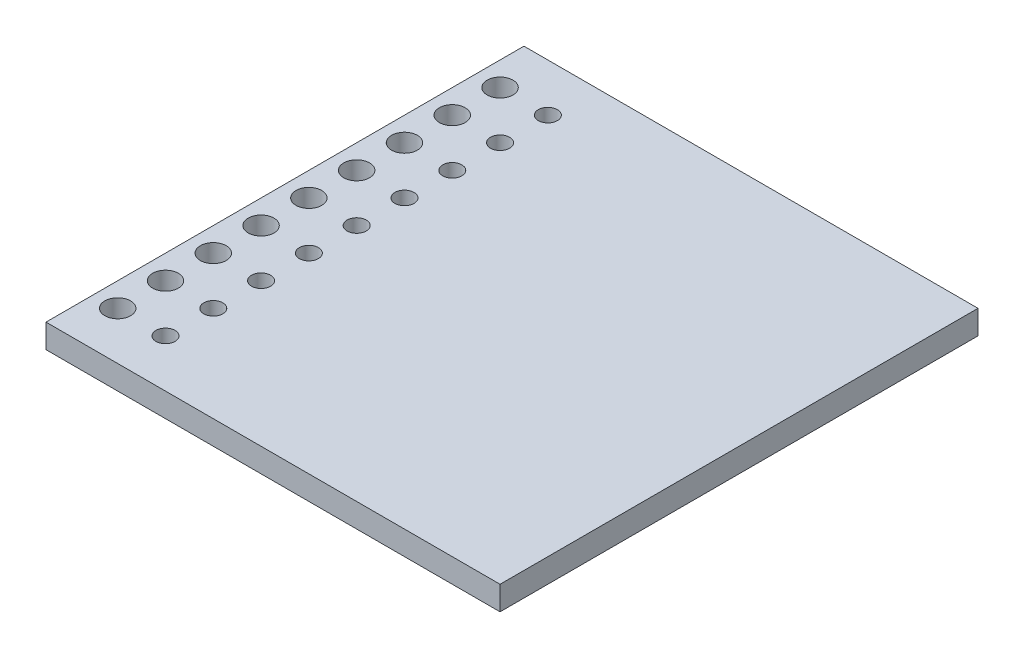
from build123d import *

# Parameters (mm, degrees)
SKETCH1_W           = 101.6
SKETCH1_H           = 127
BOSS_EXTRUDE1_DEPTH = 6.35
SKETCH3_W           = 63.5
SKETCH3_H           = 127
SKETCH3_R           = 3.429
BOSS_EXTRUDE2_DEPTH = 6.35
SKETCH4_W           = 44.45
SKETCH4_H           = 127
CUT_EXTRUDE2_DEPTH  = 131.908603613
SKETCH5_R           = 2.54
CUT_EXTRUDE4_DEPTH  = 95.612869104


with BuildPart() as part:
    # Sketch1 → Boss-Extrude1 (new body)
    with BuildSketch(Plane(origin=(0, 0, 0), x_dir=(1, 0, 0), z_dir=(0, 1, 0))):
        Rectangle(SKETCH1_W, SKETCH1_H)
    extrude(amount=BOSS_EXTRUDE1_DEPTH)

    # Sketch3 → Boss-Extrude2 (add)
    with BuildSketch(Plane(origin=(0, 6.35, 0), x_dir=(1, 0, 0), z_dir=(0, 1, 0))):
        with Locations((-82.55, 0)):
            Rectangle(SKETCH3_W, SKETCH3_H)
        with Locations(Location((-101.6, 50.8, 0), (0, 0, 270))):
            Circle(SKETCH3_R, mode=Mode.SUBTRACT)
        with Locations(Location((-88.9, 50.8, 0), (0, 0, 270))):
            Circle(SKETCH3_R, mode=Mode.SUBTRACT)
        with Locations(Location((-88.9, 38.1, 0), (0, 0, 270))):
            Circle(SKETCH3_R, mode=Mode.SUBTRACT)
        with Locations(Location((-101.6, 38.1, 0), (0, 0, 270))):
            Circle(SKETCH3_R, mode=Mode.SUBTRACT)
        with Locations(Location((-101.6, 25.4, 0), (0, 0, 270))):
            Circle(SKETCH3_R, mode=Mode.SUBTRACT)
        with Locations(Location((-88.9, 25.4, 0), (0, 0, 270))):
            Circle(SKETCH3_R, mode=Mode.SUBTRACT)
        with Locations(Location((-76.2, 50.8, 0), (0, 0, 270))):
            Circle(SKETCH3_R, mode=Mode.SUBTRACT)
        with Locations(Location((-63.5, 50.8, 0), (0, 0, 270))):
            Circle(SKETCH3_R, mode=Mode.SUBTRACT)
        with Locations(Location((-76.2, 38.1, 0), (0, 0, 270))):
            Circle(SKETCH3_R, mode=Mode.SUBTRACT)
        with Locations(Location((-63.5, 38.1, 0), (0, 0, 270))):
            Circle(SKETCH3_R, mode=Mode.SUBTRACT)
        with Locations(Location((-76.2, 25.4, 0), (0, 0, 270))):
            Circle(SKETCH3_R, mode=Mode.SUBTRACT)
        with Locations(Location((-63.5, 25.4, 0), (0, 0, 270))):
            Circle(SKETCH3_R, mode=Mode.SUBTRACT)
        with Locations(Location((-101.6, 12.7, 0), (0, 0, 270))):
            Circle(SKETCH3_R, mode=Mode.SUBTRACT)
        with Locations(Location((-88.9, 12.7, 0), (0, 0, 270))):
            Circle(SKETCH3_R, mode=Mode.SUBTRACT)
        with Locations(Location((-76.2, 12.7, 0), (0, 0, 270))):
            Circle(SKETCH3_R, mode=Mode.SUBTRACT)
        with Locations(Location((-63.5, 12.7, 0), (0, 0, 270))):
            Circle(SKETCH3_R, mode=Mode.SUBTRACT)
        with Locations(Location((-101.6, 0, 0), (0, 0, 270))):
            Circle(SKETCH3_R, mode=Mode.SUBTRACT)
        with Locations(Location((-88.9, 0, 0), (0, 0, 270))):
            Circle(SKETCH3_R, mode=Mode.SUBTRACT)
        with Locations(Location((-76.2, 0, 0), (0, 0, 270))):
            Circle(SKETCH3_R, mode=Mode.SUBTRACT)
        with Locations(Location((-63.5, 0, 0), (0, 0, 270))):
            Circle(SKETCH3_R, mode=Mode.SUBTRACT)
        with Locations(Location((-101.6, -12.7, 0), (0, 0, 270))):
            Circle(SKETCH3_R, mode=Mode.SUBTRACT)
        with Locations(Location((-88.9, -12.7, 0), (0, 0, 270))):
            Circle(SKETCH3_R, mode=Mode.SUBTRACT)
        with Locations(Location((-76.2, -12.7, 0), (0, 0, 270))):
            Circle(SKETCH3_R, mode=Mode.SUBTRACT)
        with Locations(Location((-63.5, -12.7, 0), (0, 0, 270))):
            Circle(SKETCH3_R, mode=Mode.SUBTRACT)
        with Locations(Location((-101.6, -25.4, 0), (0, 0, 270))):
            Circle(SKETCH3_R, mode=Mode.SUBTRACT)
        with Locations(Location((-88.9, -25.4, 0), (0, 0, 270))):
            Circle(SKETCH3_R, mode=Mode.SUBTRACT)
        with Locations(Location((-76.2, -25.4, 0), (0, 0, 270))):
            Circle(SKETCH3_R, mode=Mode.SUBTRACT)
        with Locations(Location((-63.5, -25.4, 0), (0, 0, 270))):
            Circle(SKETCH3_R, mode=Mode.SUBTRACT)
        with Locations(Location((-101.6, -38.1, 0), (0, 0, 270))):
            Circle(SKETCH3_R, mode=Mode.SUBTRACT)
        with Locations(Location((-88.9, -38.1, 0), (0, 0, 270))):
            Circle(SKETCH3_R, mode=Mode.SUBTRACT)
        with Locations(Location((-76.2, -38.1, 0), (0, 0, 270))):
            Circle(SKETCH3_R, mode=Mode.SUBTRACT)
        with Locations(Location((-63.5, -38.1, 0), (0, 0, 270))):
            Circle(SKETCH3_R, mode=Mode.SUBTRACT)
        with Locations(Location((-101.6, -50.8, 0), (0, 0, 270))):
            Circle(SKETCH3_R, mode=Mode.SUBTRACT)
        with Locations(Location((-88.9, -50.8, 0), (0, 0, 270))):
            Circle(SKETCH3_R, mode=Mode.SUBTRACT)
        with Locations(Location((-76.2, -50.8, 0), (0, 0, 270))):
            Circle(SKETCH3_R, mode=Mode.SUBTRACT)
        with Locations(Location((-63.5, -50.8, 0), (0, 0, 270))):
            Circle(SKETCH3_R, mode=Mode.SUBTRACT)
    extrude(amount=-BOSS_EXTRUDE2_DEPTH)

    # Sketch4 → Cut-Extrude2 (cut, through all)
    with BuildSketch(Plane(origin=(0, 6.35, 0), x_dir=(1, 0, 0), z_dir=(0, 1, 0))):
        with Locations((-92.075, 0)):
            Rectangle(SKETCH4_W, SKETCH4_H)
    extrude(amount=-CUT_EXTRUDE2_DEPTH, mode=Mode.SUBTRACT)

    # Sketch5 → Cut-Extrude4 (cut, through all)
    with BuildSketch(Plane(origin=(0, 0, 0), x_dir=(1, 0, 0), z_dir=(0, 1, 0))):
        with Locations(Location((-50.8, 50.8, 0), (0, 0, 270))):
            Circle(SKETCH5_R)
        with Locations(Location((-50.8, 38.1, 0), (0, 0, 270))):
            Circle(SKETCH5_R)
        with Locations(Location((-50.8, 25.4, 0), (0, 0, 270))):
            Circle(SKETCH5_R)
        with Locations(Location((-50.8, 12.7, 0), (0, 0, 270))):
            Circle(SKETCH5_R)
        with Locations(Location((-50.8, 0, 0), (0, 0, 270))):
            Circle(SKETCH5_R)
        with Locations(Location((-50.8, -12.7, 0), (0, 0, 270))):
            Circle(SKETCH5_R)
        with Locations(Location((-50.8, -25.4, 0), (0, 0, 270))):
            Circle(SKETCH5_R)
        with Locations(Location((-50.8, -38.1, 0), (0, 0, 270))):
            Circle(SKETCH5_R)
        with Locations(Location((-50.8, -50.8, 0), (0, 0, 270))):
            Circle(SKETCH5_R)
    extrude(amount=CUT_EXTRUDE4_DEPTH, mode=Mode.SUBTRACT)


solid = part.part
